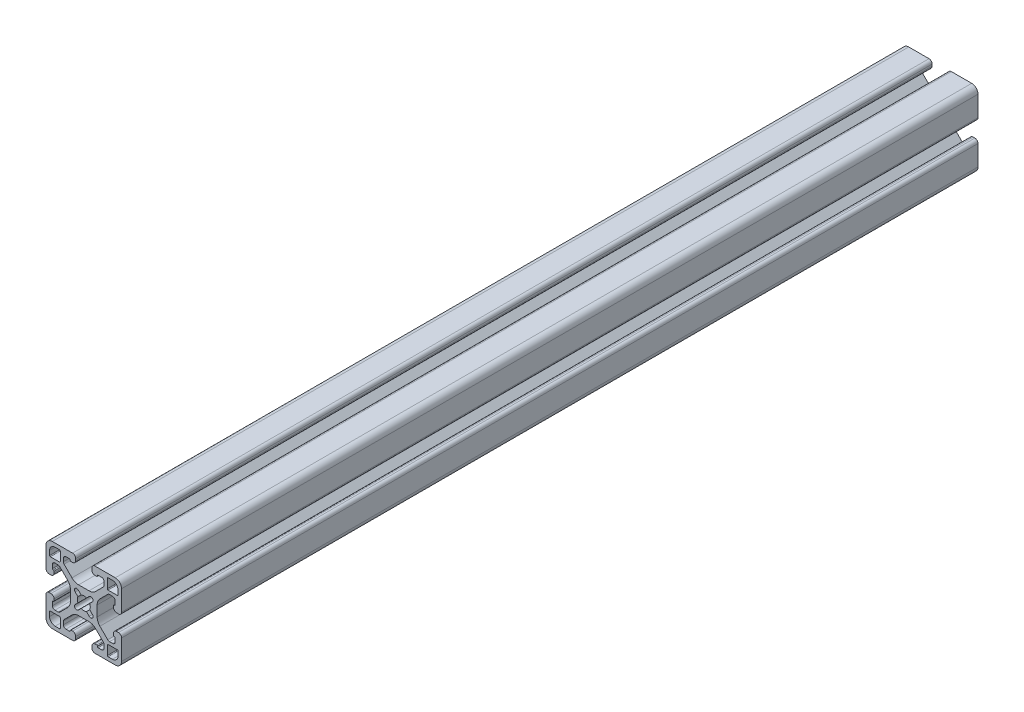
from build123d import *

# Parameters (mm, degrees)
EXTRUDE1_DEPTH = 431.8


with BuildPart() as part:
    # Sketch1 → Extrude1 (new body)
    with BuildSketch(Plane.XY):
        with BuildLine():
            Line((-46.536752228, -7.000622168), (-46.536752228, -8.774580164))
            ThreePointArc((-46.536752228, -8.774580164), (-46.907290083, -9.675221514), (-47.806745776, -10.048628264))
            Line((-47.806745776, -10.048628264), (-49.392633083, -10.048628264))
            ThreePointArc((-49.392633083, -10.048628264), (-49.878641042, -9.95195527), (-50.290658695, -9.676653876))
            Line((-50.290658695, -9.676653876), (-54.238761565, -5.728551005))
            ThreePointArc((-54.238761565, -5.728551005), (-55.26838878, -4.187604983), (-55.629945776, -2.369935216))
            Line((-55.629945776, -2.369935216), (-55.629945776, 2.846678689))
            ThreePointArc((-55.629945776, 2.846678689), (-55.26838878, 4.664348456), (-54.238761565, 6.205294478))
            Line((-54.238761565, 6.205294478), (-50.290658695, 10.153397348))
            ThreePointArc((-50.290658695, 10.153397348), (-49.878641042, 10.428698742), (-49.392633083, 10.525371736))
            Line((-49.392633083, 10.525371736), (-47.806745776, 10.525371736))
            ThreePointArc((-47.806745776, 10.525371736), (-46.907290079, 10.151964982), (-46.536752228, 9.251323623))
            Line((-46.536752228, 9.251323623), (-46.536752228, 7.47736564))
            ThreePointArc((-46.536752228, 7.47736564), (-46.648344767, 7.207957418), (-46.91775299, 7.096364878))
            Line((-46.91775299, 7.096364878), (-46.993953142, 7.096364878))
            ThreePointArc((-46.993953142, 7.096364878), (-47.263362671, 6.984771032), (-47.374953904, 6.715360422))
            Line((-47.374953904, 6.715360422), (-47.374945776, 5.877156465))
            ThreePointArc((-47.374945776, 5.877156465), (-46.913692136, 4.763614578), (-45.800145776, 4.302371736))
            Line((-45.800145776, 4.302371736), (-44.885745776, 4.302371736))
            ThreePointArc((-44.885745776, 4.302371736), (-43.772194017, 4.763619977), (-43.310945776, 5.877171736))
            Line((-43.310945776, 5.877171736), (-43.310945776, 16.113371736))
            ThreePointArc((-43.310945776, 16.113371736), (-44.240881746, 18.358435766), (-46.485945776, 19.288371736))
            Line((-46.485945776, 19.288371736), (-56.722145776, 19.288371736))
            ThreePointArc((-56.722145776, 19.288371736), (-57.835697535, 18.827123495), (-58.296945776, 17.713571736))
            Line((-58.296945776, 17.713571736), (-58.296945776, 16.799171736))
            ThreePointArc((-58.296945776, 16.799171736), (-57.835702934, 15.685625376), (-56.722161047, 15.224371736))
            Line((-56.722161047, 15.224371736), (-55.883957091, 15.224363608))
            ThreePointArc((-55.883957091, 15.224363608), (-55.61454648, 15.335954841), (-55.502952634, 15.60536437))
            Line((-55.502952634, 15.60536437), (-55.502952634, 15.681564523))
            ThreePointArc((-55.502952634, 15.681564523), (-55.391360095, 15.950972745), (-55.121951872, 16.062565285))
            Line((-55.121951872, 16.062565285), (-53.347993876, 16.062565285))
            ThreePointArc((-53.347993876, 16.062565285), (-52.447352526, 15.692027429), (-52.073945776, 14.792571736))
            Line((-52.073945776, 14.792571736), (-52.073945776, 13.206684429))
            ThreePointArc((-52.073945776, 13.206684429), (-52.17061877, 12.72067647), (-52.445920164, 12.308658817))
            Line((-52.445920164, 12.308658817), (-56.394023034, 8.360555947))
            ThreePointArc((-56.394023034, 8.360555947), (-57.934969057, 7.330928733), (-59.752638824, 6.969371736))
            Line((-59.752638824, 6.969371736), (-64.969252728, 6.969371736))
            ThreePointArc((-64.969252728, 6.969371736), (-66.786922496, 7.330928733), (-68.327868518, 8.360555947))
            Line((-68.327868518, 8.360555947), (-72.275971388, 12.308658817))
            ThreePointArc((-72.275971388, 12.308658817), (-72.551272782, 12.72067647), (-72.647945776, 13.206684429))
            Line((-72.647945776, 13.206684429), (-72.647945776, 14.792571736))
            ThreePointArc((-72.647945776, 14.792571736), (-72.274539022, 15.692027434), (-71.373897663, 16.062565285))
            Line((-71.373897663, 16.062565285), (-69.59993968, 16.062565285))
            ThreePointArc((-69.59993968, 16.062565285), (-69.330531458, 15.950972745), (-69.218938918, 15.681564523))
            Line((-69.218938918, 15.681564523), (-69.218938918, 15.60536437))
            ThreePointArc((-69.218938918, 15.60536437), (-69.107345072, 15.335954841), (-68.837934461, 15.224363608))
            Line((-68.837934461, 15.224363608), (-67.999730505, 15.224371736))
            ThreePointArc((-67.999730505, 15.224371736), (-66.886188618, 15.685625376), (-66.424945776, 16.799171736))
            Line((-66.424945776, 16.799171736), (-66.424945776, 17.713571736))
            ThreePointArc((-66.424945776, 17.713571736), (-66.886194017, 18.827123495), (-67.999745776, 19.288371736))
            Line((-67.999745776, 19.288371736), (-78.235945776, 19.288371736))
            ThreePointArc((-78.235945776, 19.288371736), (-80.481009806, 18.358435766), (-81.410945776, 16.113371736))
            Line((-81.410945776, 16.113371736), (-81.410945776, 5.877171736))
            ThreePointArc((-81.410945776, 5.877171736), (-80.949697535, 4.763619977), (-79.836145776, 4.302371736))
            Line((-79.836145776, 4.302371736), (-78.921745776, 4.302371736))
            ThreePointArc((-78.921745776, 4.302371736), (-77.808199416, 4.763614578), (-77.346945776, 5.877156465))
            Line((-77.346945776, 5.877156465), (-77.346937648, 6.715360422))
            ThreePointArc((-77.346937648, 6.715360422), (-77.458528881, 6.984771032), (-77.72793841, 7.096364878))
            Line((-77.72793841, 7.096364878), (-77.804138562, 7.096364878))
            ThreePointArc((-77.804138562, 7.096364878), (-78.073546785, 7.207957418), (-78.185139324, 7.47736564))
            Line((-78.185139324, 7.47736564), (-78.185139324, 9.251323637))
            ThreePointArc((-78.185139324, 9.251323637), (-77.814601469, 10.151964987), (-76.915145776, 10.525371736))
            Line((-76.915145776, 10.525371736), (-75.329258469, 10.525371736))
            ThreePointArc((-75.329258469, 10.525371736), (-74.84325051, 10.428698742), (-74.431232857, 10.153397348))
            Line((-74.431232857, 10.153397348), (-70.483129987, 6.205294478))
            ThreePointArc((-70.483129987, 6.205294478), (-69.453502773, 4.664348456), (-69.091945776, 2.846678689))
            Line((-69.091945776, 2.846678689), (-69.091945776, -2.369935216))
            ThreePointArc((-69.091945776, -2.369935216), (-69.453502773, -4.187604983), (-70.483129987, -5.728551005))
            Line((-70.483129987, -5.728551005), (-74.431232857, -9.676653876))
            ThreePointArc((-74.431232857, -9.676653876), (-74.84325051, -9.95195527), (-75.329258469, -10.048628264))
            Line((-75.329258469, -10.048628264), (-76.915145776, -10.048628264))
            ThreePointArc((-76.915145776, -10.048628264), (-77.814601474, -9.67522151), (-78.185139324, -8.774580151))
            Line((-78.185139324, -8.774580151), (-78.185139324, -7.000622168))
            ThreePointArc((-78.185139324, -7.000622168), (-78.073546785, -6.731213945), (-77.804138562, -6.619621406))
            Line((-77.804138562, -6.619621406), (-77.72793841, -6.619621406))
            ThreePointArc((-77.72793841, -6.619621406), (-77.458528881, -6.50802756), (-77.346937648, -6.238616949))
            Line((-77.346937648, -6.238616949), (-77.346945776, -5.400412993))
            ThreePointArc((-77.346945776, -5.400412993), (-77.808199416, -4.286871106), (-78.921745776, -3.825628264))
            Line((-78.921745776, -3.825628264), (-79.836145776, -3.825628264))
            ThreePointArc((-79.836145776, -3.825628264), (-80.949697535, -4.286876505), (-81.410945776, -5.400428264))
            Line((-81.410945776, -5.400428264), (-81.410945776, -15.636628264))
            ThreePointArc((-81.410945776, -15.636628264), (-80.481009806, -17.881692294), (-78.235945776, -18.811628264))
            Line((-78.235945776, -18.811628264), (-67.999745776, -18.811628264))
            ThreePointArc((-67.999745776, -18.811628264), (-66.886194017, -18.350380023), (-66.424945776, -17.236828264))
            Line((-66.424945776, -17.236828264), (-66.424945776, -16.322428264))
            ThreePointArc((-66.424945776, -16.322428264), (-66.886188618, -15.208881904), (-67.999730505, -14.747628264))
            Line((-67.999730505, -14.747628264), (-68.837934461, -14.747620136))
            ThreePointArc((-68.837934461, -14.747620136), (-69.107345072, -14.859211369), (-69.218938918, -15.128620898))
            Line((-69.218938918, -15.128620898), (-69.218938918, -15.20482105))
            ThreePointArc((-69.218938918, -15.20482105), (-69.330531458, -15.474229273), (-69.59993968, -15.585821812))
            Line((-69.59993968, -15.585821812), (-71.373897676, -15.585821812))
            ThreePointArc((-71.373897676, -15.585821812), (-72.274539027, -15.215283957), (-72.647945776, -14.315828264))
            Line((-72.647945776, -14.315828264), (-72.647945776, -12.729940957))
            ThreePointArc((-72.647945776, -12.729940957), (-72.551272782, -12.243932998), (-72.275971388, -11.831915345))
            Line((-72.275971388, -11.831915345), (-68.327868518, -7.883812475))
            ThreePointArc((-68.327868518, -7.883812475), (-66.786922496, -6.85418526), (-64.969252728, -6.492628264))
            Line((-64.969252728, -6.492628264), (-59.752638824, -6.492628264))
            ThreePointArc((-59.752638824, -6.492628264), (-57.934969057, -6.85418526), (-56.394023034, -7.883812475))
            Line((-56.394023034, -7.883812475), (-52.445920164, -11.831915345))
            ThreePointArc((-52.445920164, -11.831915345), (-52.17061877, -12.243932998), (-52.073945776, -12.729940957))
            Line((-52.073945776, -12.729940957), (-52.073945776, -14.315828264))
            ThreePointArc((-52.073945776, -14.315828264), (-52.44735253, -15.215283961), (-53.347993889, -15.585821812))
            Line((-53.347993889, -15.585821812), (-55.121951872, -15.585821812))
            ThreePointArc((-55.121951872, -15.585821812), (-55.391360095, -15.474229273), (-55.502952634, -15.20482105))
            Line((-55.502952634, -15.20482105), (-55.502952634, -15.128620898))
            ThreePointArc((-55.502952634, -15.128620898), (-55.61454648, -14.859211369), (-55.883957091, -14.747620136))
            Line((-55.883957091, -14.747620136), (-56.722161047, -14.747628264))
            ThreePointArc((-56.722161047, -14.747628264), (-57.835702934, -15.208881904), (-58.296945776, -16.322428264))
            Line((-58.296945776, -16.322428264), (-58.296945776, -17.236828264))
            ThreePointArc((-58.296945776, -17.236828264), (-57.835697535, -18.350380023), (-56.722145776, -18.811628264))
            Line((-56.722145776, -18.811628264), (-46.485945776, -18.811628264))
            ThreePointArc((-46.485945776, -18.811628264), (-44.240881746, -17.881692294), (-43.310945776, -15.636628264))
            Line((-43.310945776, -15.636628264), (-43.310945776, -5.400428264))
            ThreePointArc((-43.310945776, -5.400428264), (-43.772194017, -4.286876505), (-44.885745776, -3.825628264))
            Line((-44.885745776, -3.825628264), (-45.800145776, -3.825628264))
            ThreePointArc((-45.800145776, -3.825628264), (-46.913692136, -4.286871106), (-47.374945776, -5.400412993))
            Line((-47.374945776, -5.400412993), (-47.374953904, -6.238616949))
            ThreePointArc((-47.374953904, -6.238616949), (-47.263362671, -6.50802756), (-46.993953142, -6.619621406))
            Line((-46.993953142, -6.619621406), (-46.91775299, -6.619621406))
            ThreePointArc((-46.91775299, -6.619621406), (-46.648344767, -6.731213945), (-46.536752228, -7.000622168))
        make_face()
        with BuildLine():
            Line((-66.704246649, -2.488483035), (-65.333825803, -1.118062189))
            ThreePointArc((-65.333825803, -1.118062189), (-65.628655776, 0.238371736), (-65.333825803, 1.594805661))
            Line((-65.333825803, 1.594805661), (-66.704246649, 2.965226507))
            ThreePointArc((-66.704246649, 2.965226507), (-66.704246649, 4.581672609), (-65.087800547, 4.581672609))
            Line((-65.087800547, 4.581672609), (-63.717379701, 3.211251763))
            ThreePointArc((-63.717379701, 3.211251763), (-62.360945776, 3.506081736), (-61.004511851, 3.211251763))
            Line((-61.004511851, 3.211251763), (-59.721184579, 4.483982556))
            ThreePointArc((-59.721184579, 4.483982556), (-58.017644903, 4.581672609), (-58.115334956, 2.878132934))
            Line((-58.115334956, 2.878132934), (-59.38806575, 1.594805661))
            ThreePointArc((-59.38806575, 1.594805661), (-59.093235776, 0.238371736), (-59.38806575, -1.118062189))
            Line((-59.38806575, -1.118062189), (-58.017644903, -2.488483035))
            ThreePointArc((-58.017644903, -2.488483035), (-58.017644903, -4.104929137), (-59.634091005, -4.104929137))
            Line((-59.634091005, -4.104929137), (-61.004511851, -2.73450829))
            ThreePointArc((-61.004511851, -2.73450829), (-62.360945776, -3.029338264), (-63.717379701, -2.73450829))
            Line((-63.717379701, -2.73450829), (-65.087800547, -4.104929137))
            ThreePointArc((-65.087800547, -4.104929137), (-66.704246649, -4.104929137), (-66.704246649, -2.488483035))
        make_face(mode=Mode.SUBTRACT)
        with BuildLine():
            Line((-79.607545776, 12.481171736), (-79.607545776, 14.690971736))
            ThreePointArc((-79.607545776, 14.690971736), (-78.789202123, 16.666628083), (-76.813545776, 17.484971736))
            Line((-76.813545776, 17.484971736), (-74.603745776, 17.484971736))
            ThreePointArc((-74.603745776, 17.484971736), (-74.334338092, 17.37337942), (-74.222745776, 17.103971736))
            Line((-74.222745776, 17.103971736), (-74.222745776, 12.481171736))
            ThreePointArc((-74.222745776, 12.481171736), (-74.334338092, 12.211764053), (-74.603745776, 12.100171736))
            Line((-74.603745776, 12.100171736), (-79.226545776, 12.100171736))
            ThreePointArc((-79.226545776, 12.100171736), (-79.49595346, 12.211764053), (-79.607545776, 12.481171736))
        make_face(mode=Mode.SUBTRACT)
        with BuildLine():
            Line((-74.603745776, -17.008228264), (-76.813545776, -17.008228264))
            ThreePointArc((-76.813545776, -17.008228264), (-78.789202123, -16.18988461), (-79.607545776, -14.214228264))
            Line((-79.607545776, -14.214228264), (-79.607545776, -12.004428264))
            ThreePointArc((-79.607545776, -12.004428264), (-79.49595346, -11.73502058), (-79.226545776, -11.623428264))
            Line((-79.226545776, -11.623428264), (-74.603745776, -11.623428264))
            ThreePointArc((-74.603745776, -11.623428264), (-74.334338092, -11.73502058), (-74.222745776, -12.004428264))
            Line((-74.222745776, -12.004428264), (-74.222745776, -16.627228264))
            ThreePointArc((-74.222745776, -16.627228264), (-74.334338092, -16.896635947), (-74.603745776, -17.008228264))
        make_face(mode=Mode.SUBTRACT)
        with BuildLine():
            Line((-45.114345776, -12.004428264), (-45.114345776, -14.214228264))
            ThreePointArc((-45.114345776, -14.214228264), (-45.932689429, -16.18988461), (-47.908345776, -17.008228264))
            Line((-47.908345776, -17.008228264), (-50.118145776, -17.008228264))
            ThreePointArc((-50.118145776, -17.008228264), (-50.38755346, -16.896635947), (-50.499145776, -16.627228264))
            Line((-50.499145776, -16.627228264), (-50.499145776, -12.004428264))
            ThreePointArc((-50.499145776, -12.004428264), (-50.38755346, -11.73502058), (-50.118145776, -11.623428264))
            Line((-50.118145776, -11.623428264), (-45.495345776, -11.623428264))
            ThreePointArc((-45.495345776, -11.623428264), (-45.225938092, -11.73502058), (-45.114345776, -12.004428264))
        make_face(mode=Mode.SUBTRACT)
        with BuildLine():
            Line((-50.118145776, 17.484971736), (-47.908345776, 17.484971736))
            ThreePointArc((-47.908345776, 17.484971736), (-45.932689429, 16.666628083), (-45.114345776, 14.690971736))
            Line((-45.114345776, 14.690971736), (-45.114345776, 12.481171736))
            ThreePointArc((-45.114345776, 12.481171736), (-45.225938092, 12.211764053), (-45.495345776, 12.100171736))
            Line((-45.495345776, 12.100171736), (-50.118145776, 12.100171736))
            ThreePointArc((-50.118145776, 12.100171736), (-50.38755346, 12.211764053), (-50.499145776, 12.481171736))
            Line((-50.499145776, 12.481171736), (-50.499145776, 17.103971736))
            ThreePointArc((-50.499145776, 17.103971736), (-50.38755346, 17.37337942), (-50.118145776, 17.484971736))
        make_face(mode=Mode.SUBTRACT)
    extrude(amount=-EXTRUDE1_DEPTH)


solid = part.part
